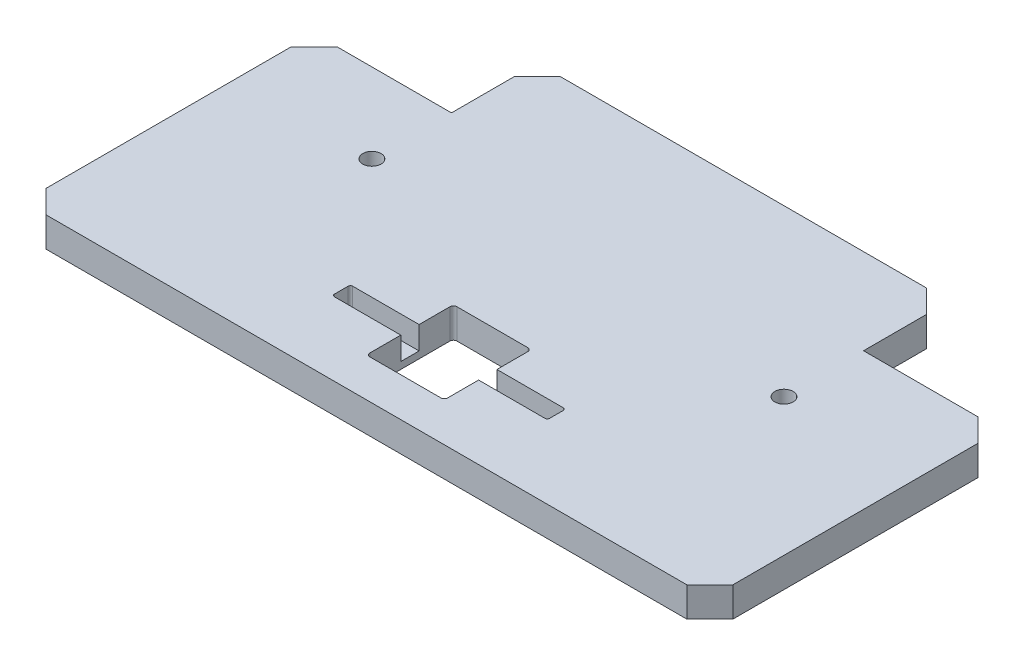
from build123d import *

# Parameters (mm, degrees)
SKETCH1_W           = 150
SKETCH1_H           = 63.315
BOSS_EXTRUDE1_DEPTH = 6.5
SKETCH3_W           = 30
SKETCH3_H           = 6.5
CUT_EXTRUDE1_DEPTH  = 18.75
CHAMFER1_SIZE       = 5
SKETCH5_R           = 5
BOSS_EXTRUDE3_DEPTH = 17.5
FILLET1_R           = 5
SKETCH6_R           = 3.5
CUT_EXTRUDE2_DEPTH  = 17.5
SKETCH7_R           = 3.5
CUT_EXTRUDE3_DEPTH  = 17.5
SKETCH8_R           = 2
CUT_EXTRUDE4_DEPTH  = 6.5
SKETCH11_W          = 150
SKETCH11_H          = 6.5
BOSS_EXTRUDE4_DEPTH = 19
SKETCH12_W          = 17
SKETCH12_H          = 19
CUT_EXTRUDE5_DEPTH  = 19
SKETCH13_W          = 15
SKETCH13_H          = 4
CUT_EXTRUDE6_DEPTH  = 5
FILLET2_R           = 0.5
FILLET3_R           = 0.75
CHAMFER2_SIZE       = 5


with BuildPart() as part:
    # Sketch1 → Boss-Extrude1 (new body)
    with BuildSketch(Plane(origin=(0, 0, 0), x_dir=(1, 0, 0), z_dir=(0, 1, 0))):
        Rectangle(SKETCH1_W, SKETCH1_H)
    extrude(amount=BOSS_EXTRUDE1_DEPTH)

    # Sketch3 → Cut-Extrude1 (cut)
    with BuildSketch(Plane(origin=(0, 0, -31.6575), x_dir=(-1, 0, 0), z_dir=(0, 0, -1))):
        with Locations((-60, 3.25)):
            Rectangle(SKETCH3_W, SKETCH3_H)
        with Locations((60, 3.25)):
            Rectangle(SKETCH3_W, SKETCH3_H)
    extrude(amount=-CUT_EXTRUDE1_DEPTH, mode=Mode.SUBTRACT)

    # Chamfer1
    chamfer1_edges = [part.edges().sort_by_distance(p)[0] for p in [
        (75, 3.25, -12.9075),
        (45, 3.25, -31.6575),
        (-75, 3.25, -12.9075),
        (-45, 3.25, -31.6575),
    ]]
    chamfer(chamfer1_edges, length=CHAMFER1_SIZE)

    # Sketch5 → Boss-Extrude3 (add)
    with BuildSketch(Plane.XZ):
        with Locations(Location((45, 4.4725, 0), (0, 0, 90))):
            Circle(SKETCH5_R)
        with Locations(Location((-45, 4.4725, 0), (0, 0, 90))):
            Circle(SKETCH5_R)
    extrude(amount=BOSS_EXTRUDE3_DEPTH)

    # Fillet1
    fillet1_edges = [part.edges().sort_by_distance(p)[0] for p in [
        (45, 0, -0.5275),
        (-45, 0, -0.5275),
    ]]
    fillet(fillet1_edges, radius=FILLET1_R)

    # Sketch6 → Cut-Extrude2 (cut)
    with BuildSketch(Plane.XZ.offset(17.5)):
        with Locations(Location((45, 4.4725, 0), (0, 0, 270))):
            Circle(SKETCH6_R)
    extrude(amount=-CUT_EXTRUDE2_DEPTH, mode=Mode.SUBTRACT)

    # Sketch7 → Cut-Extrude3 (cut)
    with BuildSketch(Plane.XZ.offset(17.5)):
        with Locations(Location((-45, 4.4725, 0), (0, 0, 270))):
            Circle(SKETCH7_R)
    extrude(amount=-CUT_EXTRUDE3_DEPTH, mode=Mode.SUBTRACT)

    # Sketch8 → Cut-Extrude4 (cut)
    with BuildSketch(Plane.XZ):
        with Locations(Location((45, 4.4725, 0), (0, 0, 270))):
            Circle(SKETCH8_R)
        with Locations(Location((-45, 4.4725, 0), (0, 0, 270))):
            Circle(SKETCH8_R)
    extrude(amount=-CUT_EXTRUDE4_DEPTH, mode=Mode.SUBTRACT)

    # Sketch11 → Boss-Extrude4 (add)
    with BuildSketch(Plane.XY.offset(31.6575)):
        with Locations((0, 3.25)):
            Rectangle(SKETCH11_W, SKETCH11_H)
    extrude(amount=BOSS_EXTRUDE4_DEPTH)

    # Sketch12 → Cut-Extrude5 (cut)
    with BuildSketch(Plane(origin=(0, 6.5, 0), x_dir=(1, 0, 0), z_dir=(0, 1, 0))):
        with Locations((0, -32.6675)):
            Rectangle(SKETCH12_W, SKETCH12_H)
    extrude(amount=-CUT_EXTRUDE5_DEPTH, mode=Mode.SUBTRACT)

    # Sketch13 → Cut-Extrude6 (cut)
    with BuildSketch(Plane(origin=(0, 6.5, 0), x_dir=(1, 0, 0), z_dir=(0, 1, 0))):
        with Locations((-16, -32.6675)):
            Rectangle(SKETCH13_W, SKETCH13_H)
        with Locations((16, -32.6675)):
            Rectangle(SKETCH13_W, SKETCH13_H)
    extrude(amount=-CUT_EXTRUDE6_DEPTH, mode=Mode.SUBTRACT)

    # Fillet2
    fillet2_edges = [part.edges().sort_by_distance(p)[0] for p in [
        (-23.5, 4, 34.6675),
        (-23.5, 4, 30.6675),
        (23.5, 4, 30.6675),
        (23.5, 4, 34.6675),
    ]]
    fillet(fillet2_edges, radius=FILLET2_R)

    # Fillet3
    fillet3_edges = [part.edges().sort_by_distance(p)[0] for p in [
        (8.5, 3.25, 42.1675),
        (-8.5, 3.25, 42.1675),
        (-8.5, 3.25, 23.1675),
        (8.5, 3.25, 23.1675),
    ]]
    fillet(fillet3_edges, radius=FILLET3_R)

    # Chamfer2
    chamfer2_edges = [part.edges().sort_by_distance(p)[0] for p in [
        (-75, 3.25, 50.6575),
        (75, 3.25, 50.6575),
    ]]
    chamfer(chamfer2_edges, length=CHAMFER2_SIZE)


solid = part.part
